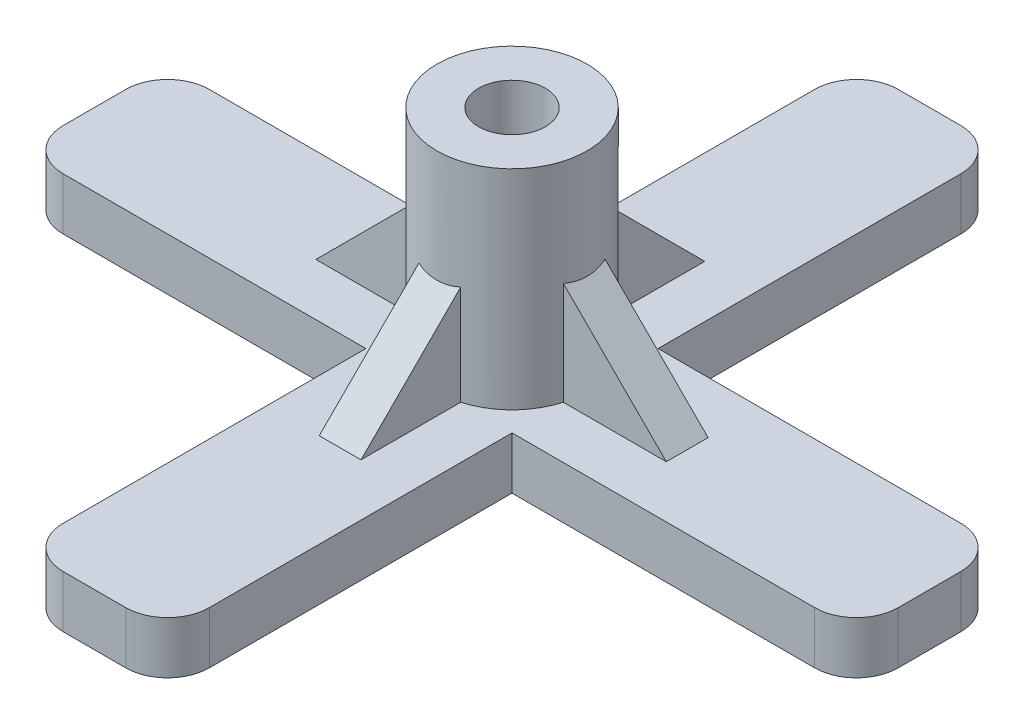
from build123d import *

# Parameters (mm, degrees)
BOSS_EXTRUDE1_DEPTH = 3.175
SKETCH2_R           = 4.572
SKETCH2_R_2         = 2.032
BOSS_EXTRUDE2_DEPTH = 12.7
BOSS_EXTRUDE3_DEPTH = 1.27
BOSS_EXTRUDE4_DEPTH = 1.27


with BuildPart() as part:
    # Sketch1 → Boss-Extrude1 (new body)
    with BuildSketch(Plane(origin=(0, 0, 0), x_dir=(1, 0, 0), z_dir=(0, 1, 0))):
        with BuildLine():
            Line((-25.4, 1.905), (-25.4, -1.905))
            ThreePointArc((-25.4, -1.905), (-24.656051224, -3.701051224), (-22.86, -4.445))
            Line((-22.86, -4.445), (-4.445, -4.445))
            Line((-4.445, -4.445), (-4.445, -22.86))
            ThreePointArc((-4.445, -22.86), (-3.701051224, -24.656051224), (-1.905, -25.4))
            Line((-1.905, -25.4), (1.905, -25.4))
            ThreePointArc((1.905, -25.4), (3.701051224, -24.656051224), (4.445, -22.86))
            Line((4.445, -22.86), (4.445, -4.445))
            Line((4.445, -4.445), (22.86, -4.445))
            ThreePointArc((22.86, -4.445), (24.656051224, -3.701051224), (25.4, -1.905))
            Line((25.4, -1.905), (25.4, 1.905))
            ThreePointArc((25.4, 1.905), (24.656051224, 3.701051224), (22.86, 4.445))
            Line((22.86, 4.445), (4.445, 4.445))
            Line((4.445, 4.445), (4.445, 22.86))
            ThreePointArc((4.445, 22.86), (3.701051224, 24.656051224), (1.905, 25.4))
            Line((1.905, 25.4), (-1.905, 25.4))
            ThreePointArc((-1.905, 25.4), (-3.701051224, 24.656051224), (-4.445, 22.86))
            Line((-4.445, 22.86), (-4.445, 4.445))
            Line((-4.445, 4.445), (-22.86, 4.445))
            ThreePointArc((-22.86, 4.445), (-24.656051224, 3.701051224), (-25.4, 1.905))
        make_face()
    extrude(amount=BOSS_EXTRUDE1_DEPTH)

    # Sketch2 → Boss-Extrude2 (add)
    with BuildSketch(Plane(origin=(0, 3.175, 0), x_dir=(1, 0, 0), z_dir=(0, 1, 0))):
        with Locations(Location((0, 0, 0), (0, 0, 90))):
            Circle(SKETCH2_R)
        with Locations(Location((0, 0, 0), (0, 0, 270))):
            Circle(SKETCH2_R_2, mode=Mode.SUBTRACT)
    extrude(amount=BOSS_EXTRUDE2_DEPTH)

    # Sketch9 → Boss-Extrude3 (add, symmetric)
    with BuildSketch(Plane.XY):
        Polygon((-10.659295588, 3.175), (-4.309295588, 3.175), (-4.309295588, 9.525), align=None)
        Polygon((10.659295588, 3.175), (4.309295588, 3.175), (4.309295588, 9.525), align=None)
    extrude(amount=BOSS_EXTRUDE3_DEPTH, both=True)

    # Sketch10 → Boss-Extrude4 (add, symmetric)
    with BuildSketch(Plane(origin=(0, 0, 0), x_dir=(0, 0, -1), z_dir=(1, 0, 0))):
        Polygon((-10.456553942, 3.175), (-4.106553942, 3.175), (-4.106553942, 9.525), align=None)
        Polygon((4.106553942, 9.525), (10.456553942, 3.175), (4.106553942, 3.175), align=None)
    extrude(amount=BOSS_EXTRUDE4_DEPTH, both=True)


solid = part.part
